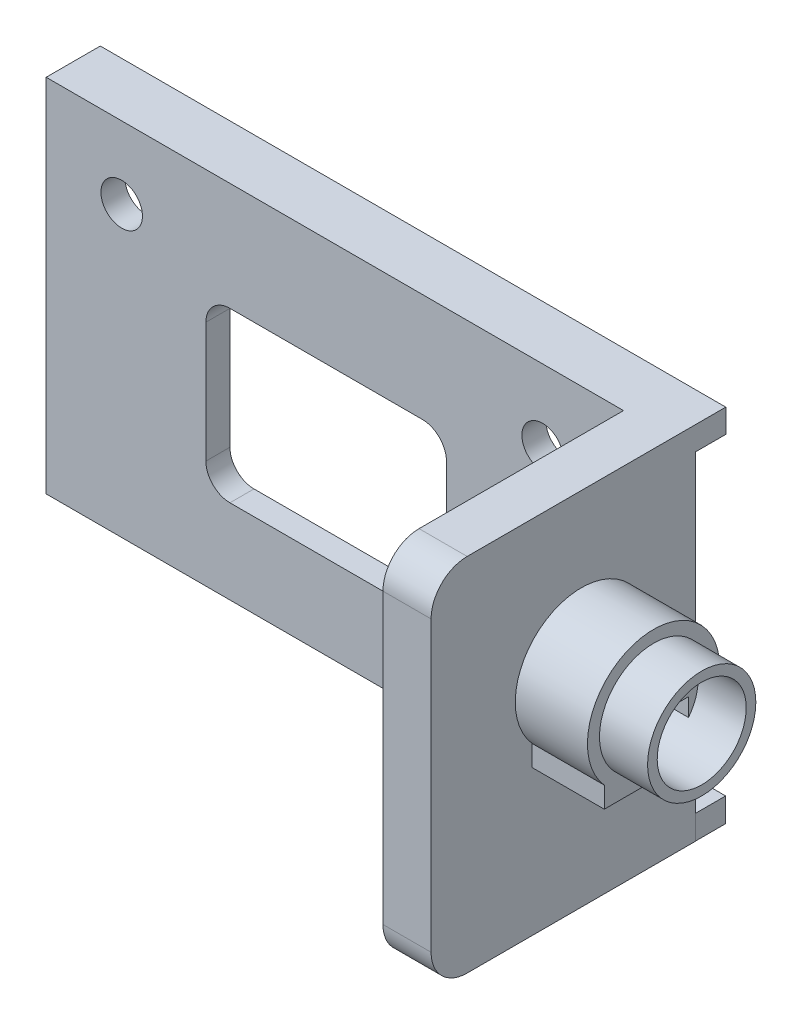
from build123d import *

# Parameters (mm, degrees)
SKETCH1_W           = 52
SKETCH1_H           = 30
BOSS_EXTRUDE1_DEPTH = 2
SKETCH2_W           = 4
SKETCH2_H           = 30
BOSS_EXTRUDE2_DEPTH = 20
FILLET1_R           = 3
SKETCH4_R           = 1.725
CUT_EXTRUDE2_DEPTH  = 2
SKETCH5_W           = 51.988371154
SKETCH5_H           = 2
BOSS_EXTRUDE3_DEPTH = 2.5
SKETCH6_W           = 20
SKETCH6_H           = 14
CUT_EXTRUDE3_DEPTH  = 2
SKETCH7_W           = 8.2
SKETCH7_H           = 5.8
SKETCH7_W_2         = 5.8
SKETCH7_H_2         = 3.4
BOSS_EXTRUDE4_DEPTH = 6
SKETCH8_R           = 5.5
SKETCH8_R_2         = 4.25
BOSS_EXTRUDE5_DEPTH = 6
SKETCH10_R          = 4.5
SKETCH10_R_2        = 3.7
BOSS_EXTRUDE6_DEPTH = 10
FILLET2_R           = 2


with BuildPart() as part:
    # Sketch1 → Boss-Extrude1 (new body)
    with BuildSketch(Plane.XY):
        with Locations((26, -15)):
            Rectangle(SKETCH1_W, SKETCH1_H)
    extrude(amount=BOSS_EXTRUDE1_DEPTH)

    # Sketch2 → Boss-Extrude2 (add)
    with BuildSketch(Plane(origin=(0, 0, 2), x_dir=(-1, 0, 0), z_dir=(0, 0, -1))):
        with Locations((-50, -15)):
            Rectangle(SKETCH2_W, SKETCH2_H)
    extrude(amount=-BOSS_EXTRUDE2_DEPTH)

    # Fillet1
    fillet1_edges = [part.edges().sort_by_distance(p)[0] for p in [
        (50, -30, 22),
        (50, 0, 22),
    ]]
    fillet(fillet1_edges, radius=FILLET1_R)

    # Sketch4 → Cut-Extrude2 (cut)
    with BuildSketch(Plane.XY.offset(2)):
        with Locations((41.277695867, -6)):
            Circle(SKETCH4_R)
        with Locations((6.277695867, -6)):
            Circle(SKETCH4_R)
    extrude(amount=-CUT_EXTRUDE2_DEPTH, mode=Mode.SUBTRACT)

    # Sketch5 → Boss-Extrude3 (add)
    with BuildSketch(Plane(origin=(0, 0, 0), x_dir=(-1, 0, 0), z_dir=(0, 0, -1))):
        with Locations((-25.994185577, -29)):
            Rectangle(SKETCH5_W, SKETCH5_H)
        Polygon((-52, -1.965960074), (0, -2.193486325), (0, 0), (-52, 0), align=None)
    extrude(amount=BOSS_EXTRUDE3_DEPTH)

    # Sketch6 → Cut-Extrude3 (cut)
    with BuildSketch(Plane.XY.offset(2)):
        with Locations((23.277695867, -16)):
            Rectangle(SKETCH6_W, SKETCH6_H)
    extrude(amount=-CUT_EXTRUDE3_DEPTH, mode=Mode.SUBTRACT)

    # Sketch7 → Boss-Extrude4 (add)
    with BuildSketch(Plane(origin=(52, 0, 0), x_dir=(0, 0, -1), z_dir=(1, 0, 0))):
        with Locations((-9.5, -15)):
            Rectangle(SKETCH7_W, SKETCH7_H)
        with Locations((-9.5, -15)):
            Rectangle(SKETCH7_W_2, SKETCH7_H_2, mode=Mode.SUBTRACT)
    extrude(amount=BOSS_EXTRUDE4_DEPTH)

    # Sketch8 → Boss-Extrude5 (add)
    with BuildSketch(Plane(origin=(52, 0, 0), x_dir=(0, 0, -1), z_dir=(1, 0, 0))):
        with Locations((-9.5, -12.5)):
            Circle(SKETCH8_R)
        with Locations((-9.5, -12.5)):
            Circle(SKETCH8_R_2, mode=Mode.SUBTRACT)
    extrude(amount=BOSS_EXTRUDE5_DEPTH)

    # Sketch10 → Boss-Extrude6 (add)
    with BuildSketch(Plane(origin=(52, 0, 0), x_dir=(0, 0, -1), z_dir=(1, 0, 0))):
        with Locations(Location((-9.5, -12.5, 0), (0, 0, 180))):
            Circle(SKETCH10_R)
        with Locations(Location((-9.5, -12.5, 0), (0, 0, 173.793732249))):
            Circle(SKETCH10_R_2, mode=Mode.SUBTRACT)
    extrude(amount=BOSS_EXTRUDE6_DEPTH)

    # Fillet2
    fillet2_edges = [part.edges().sort_by_distance(p)[0] for p in [
        (33.277695867, -9, 1),
        (33.277695867, -23, 1),
        (13.277695867, -23, 1),
        (13.277695867, -9, 1),
    ]]
    fillet(fillet2_edges, radius=FILLET2_R)


solid = part.part
